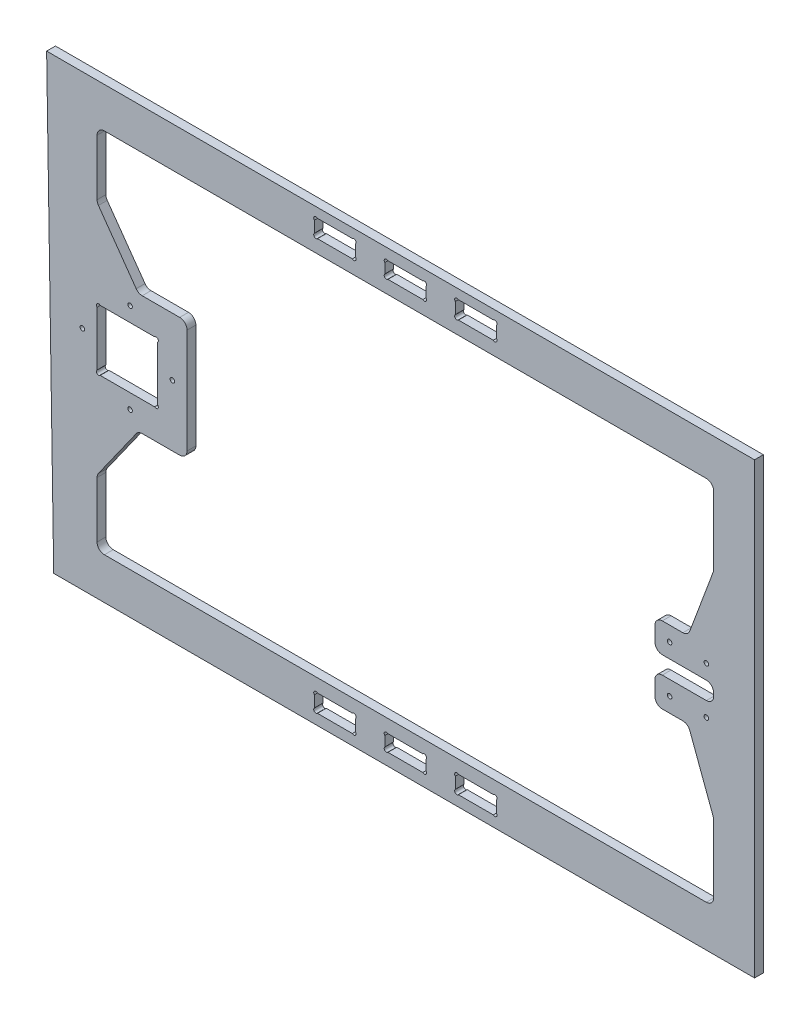
from build123d import *

# Parameters (mm, degrees)
CROQUIS1_R              = 3.1
SALIENTE_EXTRUIR1_DEPTH = 12


with BuildPart() as part:
    # Croquis1 → Saliente-Extruir1 (new body)
    with BuildSketch(Plane.XY):
        Polygon((331.272984938, 614.597621835), (321.632458304, 1225.948656715), (1286.013878227, 1225.948656715), (1286.013878227, 614.597621835), align=None)
        with Locations((1170.33582343, 889.102037351)):
            Circle(CROQUIS1_R, mode=Mode.SUBTRACT)
        with Locations((1220.33582343, 889.102037351)):
            Circle(CROQUIS1_R, mode=Mode.SUBTRACT)
        with Locations((1220.33582343, 953.102037351)):
            Circle(CROQUIS1_R, mode=Mode.SUBTRACT)
        with Locations((1170.33582343, 953.102037351)):
            Circle(CROQUIS1_R, mode=Mode.SUBTRACT)
        with Locations((435.286525189, 859.802037351)):
            Circle(CROQUIS1_R, mode=Mode.SUBTRACT)
        with Locations((370.33582343, 923.276635067)):
            Circle(CROQUIS1_R, mode=Mode.SUBTRACT)
        with Locations((435.286525189, 982.402037351)):
            Circle(CROQUIS1_R, mode=Mode.SUBTRACT)
        with Locations((492.93582343, 923.276635067)):
            Circle(CROQUIS1_R, mode=Mode.SUBTRACT)
        with BuildLine():
            Line((394.578464117, 962.402037351), (468.693182742, 962.402037351))
            ThreePointArc((468.693182742, 962.402037351), (472.93582343, 962.402037351), (472.93582343, 958.159396664))
            Line((472.93582343, 958.159396664), (472.93582343, 884.044678039))
            ThreePointArc((472.93582343, 884.044678039), (472.93582343, 879.802037351), (468.693182742, 879.802037351))
            Line((468.693182742, 879.802037351), (394.578464117, 879.802037351))
            ThreePointArc((394.578464117, 879.802037351), (390.33582343, 879.802037351), (390.33582343, 884.044678039))
            Line((390.33582343, 884.044678039), (390.33582343, 958.159396664))
            ThreePointArc((390.33582343, 958.159396664), (390.33582343, 962.402037351), (394.578464117, 962.402037351))
        make_face(mode=Mode.SUBTRACT)
        with BuildLine():
            Line((742.33582343, 1208.859396664), (742.33582343, 1193.344678039))
            ThreePointArc((742.33582343, 1193.344678039), (742.33582343, 1189.102037351), (738.093182742, 1189.102037351))
            Line((738.093182742, 1189.102037351), (690.578464117, 1189.102037351))
            ThreePointArc((690.578464117, 1189.102037351), (686.33582343, 1189.102037351), (686.33582343, 1193.344678039))
            Line((686.33582343, 1193.344678039), (686.33582343, 1208.859396664))
            ThreePointArc((686.33582343, 1208.859396664), (686.33582343, 1213.102037351), (690.578464117, 1213.102037351))
            Line((690.578464117, 1213.102037351), (738.093182742, 1213.102037351))
            ThreePointArc((738.093182742, 1213.102037351), (742.33582343, 1213.102037351), (742.33582343, 1208.859396664))
        make_face(mode=Mode.SUBTRACT)
        with BuildLine():
            Line((934.33582343, 648.859396664), (934.33582343, 633.344678039))
            ThreePointArc((934.33582343, 633.344678039), (934.33582343, 629.102037351), (930.093182742, 629.102037351))
            Line((930.093182742, 629.102037351), (882.578464117, 629.102037351))
            ThreePointArc((882.578464117, 629.102037351), (878.33582343, 629.102037351), (878.33582343, 633.344678039))
            Line((878.33582343, 633.344678039), (878.33582343, 648.859396664))
            ThreePointArc((878.33582343, 648.859396664), (878.33582343, 653.102037351), (882.578464117, 653.102037351))
            Line((882.578464117, 653.102037351), (930.093182742, 653.102037351))
            ThreePointArc((930.093182742, 653.102037351), (934.33582343, 653.102037351), (934.33582343, 648.859396664))
        make_face(mode=Mode.SUBTRACT)
        with BuildLine():
            Line((690.578464117, 653.102037351), (738.093182742, 653.102037351))
            ThreePointArc((738.093182742, 653.102037351), (742.33582343, 653.102037351), (742.33582343, 648.859396664))
            Line((742.33582343, 648.859396664), (742.33582343, 633.344678039))
            ThreePointArc((742.33582343, 633.344678039), (742.33582343, 629.102037351), (738.093182742, 629.102037351))
            Line((738.093182742, 629.102037351), (690.578464117, 629.102037351))
            ThreePointArc((690.578464117, 629.102037351), (686.33582343, 629.102037351), (686.33582343, 633.344678039))
            Line((686.33582343, 633.344678039), (686.33582343, 648.859396664))
            ThreePointArc((686.33582343, 648.859396664), (686.33582343, 653.102037351), (690.578464117, 653.102037351))
        make_face(mode=Mode.SUBTRACT)
        with BuildLine():
            Line((1220.33582343, 671.102037351), (400.33582343, 671.102037351))
            ThreePointArc((400.33582343, 671.102037351), (393.264755618, 674.03096954), (390.33582343, 681.102037351))
            Line((390.33582343, 681.102037351), (390.33582343, 757.264835053))
            ThreePointArc((390.33582343, 757.264835053), (390.808048943, 760.301529527), (392.180126095, 763.05142308))
            Line((392.180126095, 763.05142308), (443.646345243, 835.588625378))
            ThreePointArc((443.646345243, 835.588625378), (447.212155883, 838.686458556), (451.802042577, 839.802037351))
            Line((451.802042577, 839.802037351), (502.93582343, 839.802037351))
            ThreePointArc((502.93582343, 839.802037351), (510.006891241, 842.73096954), (512.93582343, 849.802037351))
            Line((512.93582343, 849.802037351), (512.93582343, 992.402037351))
            ThreePointArc((512.93582343, 992.402037351), (510.006891241, 999.473105163), (502.93582343, 1002.402037351))
            Line((502.93582343, 1002.402037351), (451.802042577, 1002.402037351))
            ThreePointArc((451.802042577, 1002.402037351), (447.212155883, 1003.517616147), (443.646345243, 1006.615449325))
            Line((443.646345243, 1006.615449325), (392.180126095, 1079.152651623))
            ThreePointArc((392.180126095, 1079.152651623), (390.808048943, 1081.902545176), (390.33582343, 1084.93923965))
            Line((390.33582343, 1084.93923965), (390.33582343, 1161.102037351))
            ThreePointArc((390.33582343, 1161.102037351), (393.264755618, 1168.173105163), (400.33582343, 1171.102037351))
            Line((400.33582343, 1171.102037351), (1220.33582343, 1171.102037351))
            ThreePointArc((1220.33582343, 1171.102037351), (1227.406891241, 1168.173105163), (1230.33582343, 1161.102037351))
            Line((1230.33582343, 1161.102037351), (1230.33582343, 1068.903333434))
            ThreePointArc((1230.33582343, 1068.903333434), (1230.177434198, 1067.130567942), (1229.707283932, 1065.413959843))
            Line((1229.707283932, 1065.413959843), (1197.759992837, 979.61266376))
            ThreePointArc((1197.759992837, 979.61266376), (1194.094067546, 974.889433139), (1188.388532335, 973.102037351))
            Line((1188.388532335, 973.102037351), (1160.33582343, 973.102037351))
            ThreePointArc((1160.33582343, 973.102037351), (1153.264755618, 970.173105163), (1150.33582343, 963.102037351))
            Line((1150.33582343, 963.102037351), (1150.33582343, 943.102037351))
            ThreePointArc((1150.33582343, 943.102037351), (1153.264755618, 936.03096954), (1160.33582343, 933.102037351))
            Line((1160.33582343, 933.102037351), (1220.33582343, 933.102037351))
            ThreePointArc((1220.33582343, 933.102037351), (1227.406891241, 930.173105163), (1230.33582343, 923.102037351))
            Line((1230.33582343, 923.102037351), (1230.33582343, 919.102037351))
            ThreePointArc((1230.33582343, 919.102037351), (1227.406891241, 912.03096954), (1220.33582343, 909.102037351))
            Line((1220.33582343, 909.102037351), (1160.33582343, 909.102037351))
            ThreePointArc((1160.33582343, 909.102037351), (1153.264755618, 906.173105163), (1150.33582343, 899.102037351))
            Line((1150.33582343, 899.102037351), (1150.33582343, 879.102037351))
            ThreePointArc((1150.33582343, 879.102037351), (1153.264755618, 872.03096954), (1160.33582343, 869.102037351))
            Line((1160.33582343, 869.102037351), (1188.388532335, 869.102037351))
            ThreePointArc((1188.388532335, 869.102037351), (1194.094067546, 867.314641564), (1197.759992837, 862.591410943))
            Line((1197.759992837, 862.591410943), (1229.707283932, 776.79011486))
            ThreePointArc((1229.707283932, 776.79011486), (1230.177434198, 775.073506761), (1230.33582343, 773.300741269))
            Line((1230.33582343, 773.300741269), (1230.33582343, 681.102037351))
            ThreePointArc((1230.33582343, 681.102037351), (1227.406891241, 674.03096954), (1220.33582343, 671.102037351))
        make_face(mode=Mode.SUBTRACT)
        with BuildLine():
            Line((786.578464117, 653.102037351), (834.093182742, 653.102037351))
            ThreePointArc((834.093182742, 653.102037351), (838.33582343, 653.102037351), (838.33582343, 648.859396664))
            Line((838.33582343, 648.859396664), (838.33582343, 635.344678039))
            ThreePointArc((838.33582343, 635.344678039), (838.33582343, 631.102037351), (834.093182742, 631.102037351))
            Line((834.093182742, 631.102037351), (786.578464117, 631.102037351))
            ThreePointArc((786.578464117, 631.102037351), (782.33582343, 631.102037351), (782.33582343, 635.344678039))
            Line((782.33582343, 635.344678039), (782.33582343, 648.859396664))
            ThreePointArc((782.33582343, 648.859396664), (782.33582343, 653.102037351), (786.578464117, 653.102037351))
        make_face(mode=Mode.SUBTRACT)
        with BuildLine():
            Line((934.33582343, 1208.859396664), (934.33582343, 1193.344678039))
            ThreePointArc((934.33582343, 1193.344678039), (934.33582343, 1189.102037351), (930.093182742, 1189.102037351))
            Line((930.093182742, 1189.102037351), (882.578464117, 1189.102037351))
            ThreePointArc((882.578464117, 1189.102037351), (878.33582343, 1189.102037351), (878.33582343, 1193.344678039))
            Line((878.33582343, 1193.344678039), (878.33582343, 1208.859396664))
            ThreePointArc((878.33582343, 1208.859396664), (878.33582343, 1213.102037351), (882.578464117, 1213.102037351))
            Line((882.578464117, 1213.102037351), (930.093182742, 1213.102037351))
            ThreePointArc((930.093182742, 1213.102037351), (934.33582343, 1213.102037351), (934.33582343, 1208.859396664))
        make_face(mode=Mode.SUBTRACT)
        with BuildLine():
            Line((838.33582343, 1206.859396664), (838.33582343, 1193.344678039))
            ThreePointArc((838.33582343, 1193.344678039), (838.33582343, 1189.102037351), (834.093182742, 1189.102037351))
            Line((834.093182742, 1189.102037351), (786.578464117, 1189.102037351))
            ThreePointArc((786.578464117, 1189.102037351), (782.33582343, 1189.102037351), (782.33582343, 1193.344678039))
            Line((782.33582343, 1193.344678039), (782.33582343, 1206.859396664))
            ThreePointArc((782.33582343, 1206.859396664), (782.33582343, 1211.102037351), (786.578464117, 1211.102037351))
            Line((786.578464117, 1211.102037351), (834.093182742, 1211.102037351))
            ThreePointArc((834.093182742, 1211.102037351), (838.33582343, 1211.102037351), (838.33582343, 1206.859396664))
        make_face(mode=Mode.SUBTRACT)
    extrude(amount=SALIENTE_EXTRUIR1_DEPTH)


solid = part.part
